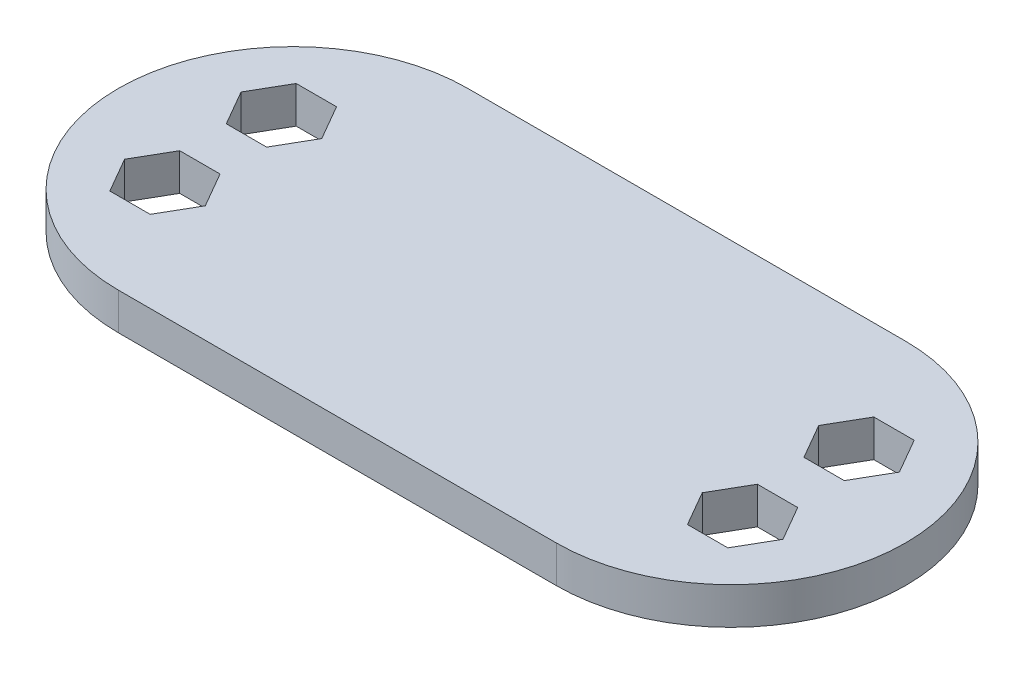
from build123d import *

# Parameters (mm, degrees)
BOSS_EXTRUDE1_DEPTH = 3.175


with BuildPart() as part:
    # Sketch2 → Boss-Extrude1 (new body)
    with BuildSketch(Plane(origin=(0, 0, 0), x_dir=(1, 0, 0), z_dir=(0, 1, 0))):
        with BuildLine():
            Line((-145.521414695, 0.997059393), (-107.921414695, 0.997059393))
            ThreePointArc((-107.921414695, 0.997059393), (-92.921414695, -14.002940607), (-107.921414695, -29.002940607))
            Line((-107.921414695, -29.002940607), (-145.521414695, -29.002940607))
            ThreePointArc((-145.521414695, -29.002940607), (-160.521414695, -14.002940607), (-145.521414695, 0.997059393))
        make_face()
        Polygon((-149.789363887, -12.002940607), (-148.05731308, -9.002940607), (-149.789363887, -6.002940607), (-153.253465503, -6.002940607), (-154.98551631, -9.002940607), (-153.253465503, -12.002940607), align=None, mode=Mode.SUBTRACT)
        Polygon((-153.253465503, -16.002940607), (-149.789363887, -16.002940607), (-148.05731308, -19.002940607), (-149.789363887, -22.002940607), (-153.253465503, -22.002940607), (-154.98551631, -19.002940607), align=None, mode=Mode.SUBTRACT)
        Polygon((-103.653465503, -16.002940607), (-105.38551631, -19.002940607), (-103.653465503, -22.002940607), (-100.189363887, -22.002940607), (-98.45731308, -19.002940607), (-100.189363887, -16.002940607), align=None, mode=Mode.SUBTRACT)
        Polygon((-100.189363887, -12.002940607), (-103.653465503, -12.002940607), (-105.38551631, -9.002940607), (-103.653465503, -6.002940607), (-100.189363887, -6.002940607), (-98.45731308, -9.002940607), align=None, mode=Mode.SUBTRACT)
    extrude(amount=BOSS_EXTRUDE1_DEPTH)


solid = part.part
